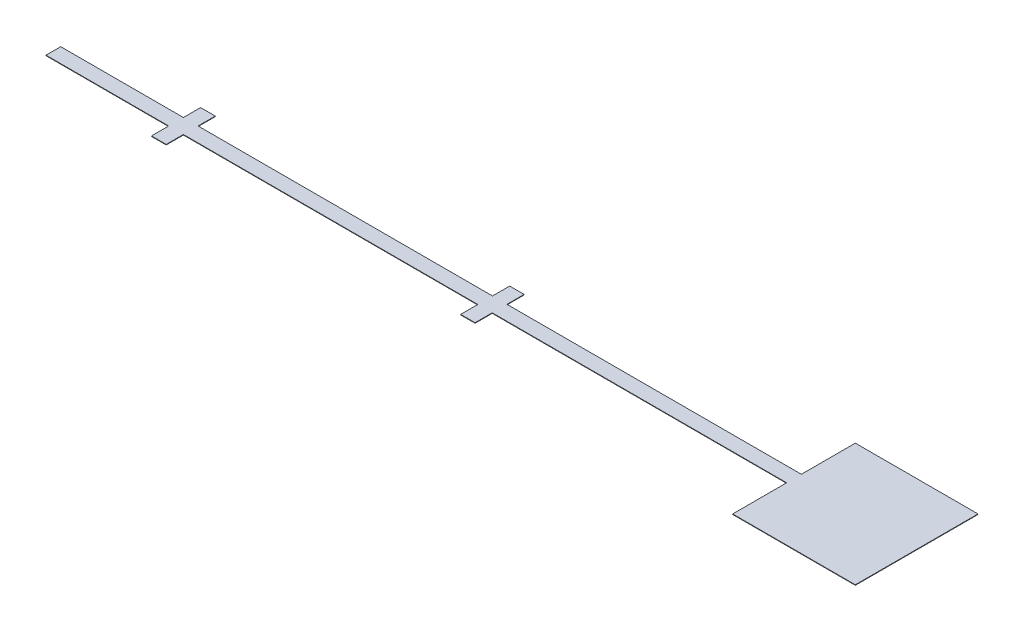
from build123d import *

# Parameters (mm, degrees)
BOSS_EXTRUDE1_DEPTH = 1


with BuildPart() as part:
    # Sketch1 → Boss-Extrude1 (new body)
    with BuildSketch(Plane(origin=(0, 0, 0), x_dir=(1, 0, 0), z_dir=(0, 1, 0))):
        Polygon((-224.444444444, 42.777777778), (-224.444444444, 12.777777778), (25.555555556, 12.777777778), (25.555555556, -22.222222222), (55.555555556, -22.222222222), (55.555555556, 12.777777778), (655.555555556, 12.777777778), (655.555555556, -22.222222222), (685, -22.222222222), (685, 12.777777778), (1285, 12.777777778), (1285, -97.222222222), (1535, -97.222222222), (1535, 152.777777778), (1285, 152.777777778), (1285, 42.777777778), (685, 42.777777778), (685, 77.777777778), (655.555555556, 77.777777778), (655.555555556, 42.777777778), (55.555555556, 42.777777778), (55.555555556, 77.777777778), (25.555555556, 77.777777778), (25.555555556, 42.777777778), align=None)
    extrude(amount=BOSS_EXTRUDE1_DEPTH)


solid = part.part
